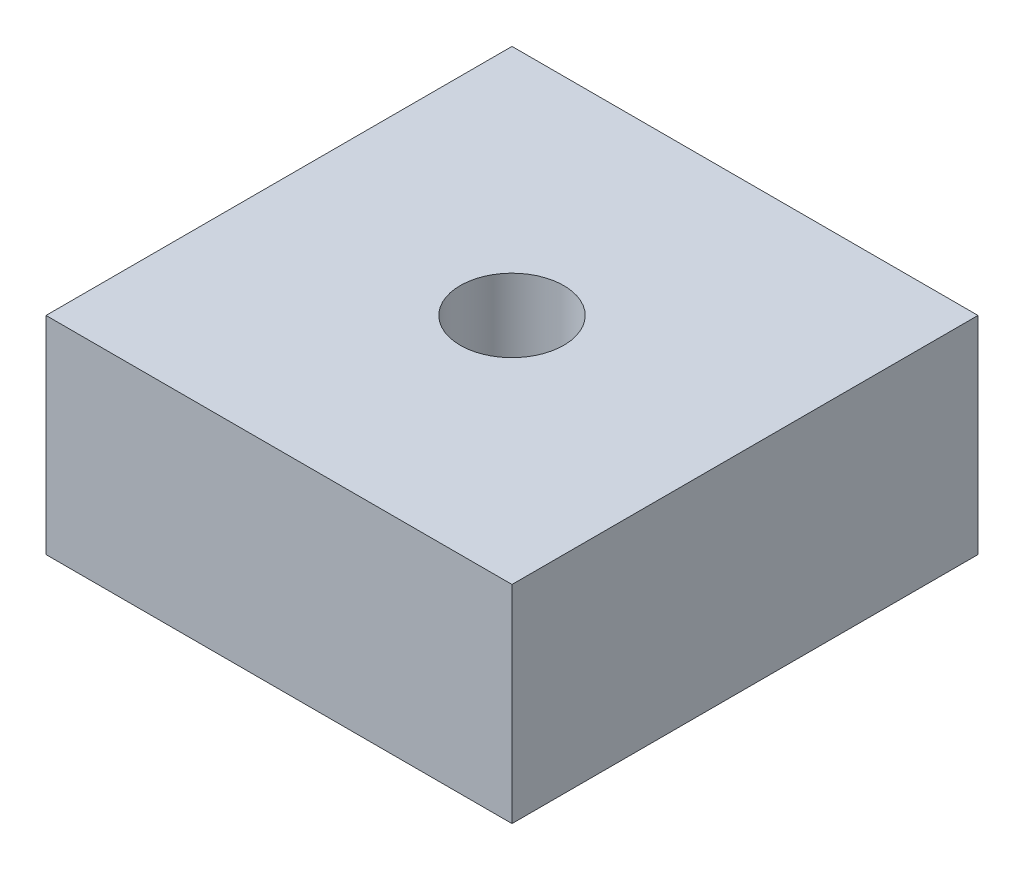
from build123d import *

# Parameters (mm, degrees)
SKETCH1_W           = 9
SKETCH1_H           = 9
SKETCH1_R           = 1
BOSS_EXTRUDE1_DEPTH = 4


with BuildPart() as part:
    # Sketch1 → Boss-Extrude1 (new body)
    with BuildSketch(Plane(origin=(0, 0, 0), x_dir=(1, 0, 0), z_dir=(0, 1, 0))):
        with Locations((4.5, 4.5)):
            Rectangle(SKETCH1_W, SKETCH1_H)
        with Locations(Location((4.5, 4.5, 0), (0, 0, 270))):
            Circle(SKETCH1_R, mode=Mode.SUBTRACT)
    extrude(amount=BOSS_EXTRUDE1_DEPTH)


solid = part.part
